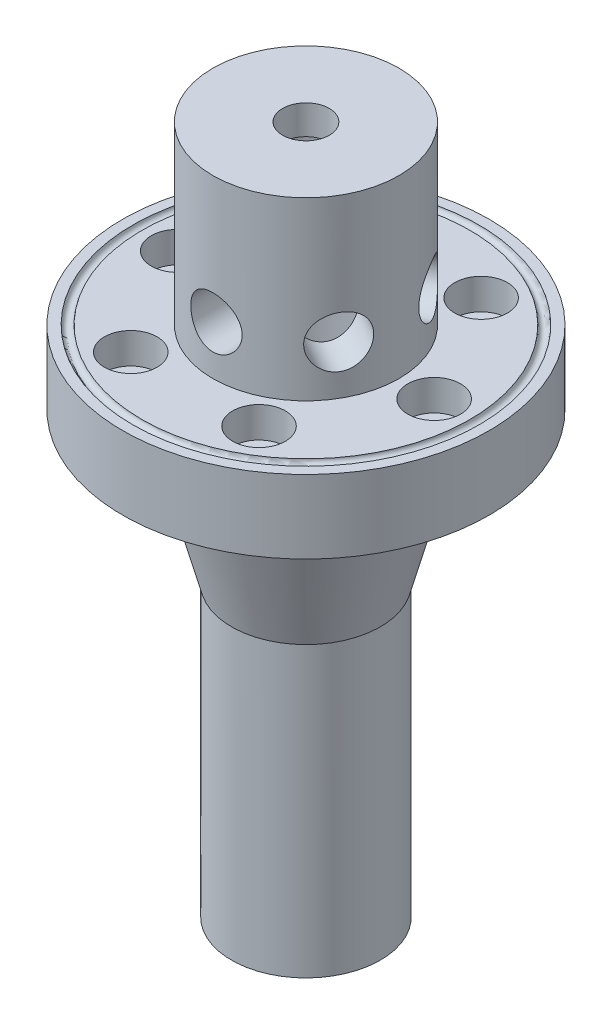
from build123d import *

# Parameters (mm, degrees)
SKETCH5_R                  = 7.5
CUT_EXTRUDE1_DEPTH         = 90
SKETCH6_R                  = 3.5
CUT_EXTRUDE2_DEPTH         = 20
CIRPATTERN1_COUNT          = 6
SKETCH11_R                 = 3.18
CUT_EXTRUDE4_DEPTH         = 101.429079548
F_4_2_4_2_DIAMETER_HOLE1_D = 4.2
CIRPATTERN2_COUNT          = 6
SKETCH15_R                 = 3.6
CUT_EXTRUDE5_DEPTH         = 4.2
CIRPATTERN3_COUNT          = 6
CUT_SWEEP1_PROFILE_R       = 0.625


with BuildPart() as part:
    # Sketch1 → Revolve1 (revolve)
    with BuildSketch(Plane(origin=(0, 0, 0), x_dir=(0, 0, -1), z_dir=(1, 0, 0))):
        Polygon((0, 34), (12.7, 34), (12.7, 10), (25, 10), (25, 0), (15.68, 0), (10.16, -20.600920458), (10.16, -60), (0, -60), align=None)
    revolve(axis=Axis((0, 0, 0), (0, 1, 0)))

    # Sketch5 → Cut-Extrude1 (cut)
    with BuildSketch(Plane.XZ.offset(60)):
        with Locations(Location((0, 0, 0), (0, 0, 270))):
            Circle(SKETCH5_R)
    extrude(amount=-CUT_EXTRUDE1_DEPTH, mode=Mode.SUBTRACT)

    # Sketch6 → Cut-Extrude2 (cut, symmetric)
    with BuildSketch(Plane.XY):
        with Locations((0, 16.659966967)):
            Circle(SKETCH6_R)
    cut_extrude2 = extrude(amount=CUT_EXTRUDE2_DEPTH, both=True, mode=Mode.SUBTRACT)

    # CirPattern1: Cut-Extrude2 ×6 about axis
    cirpattern1_axis = Axis((0, 34, 0), (0, -1, 0))
    for i in range(1, CIRPATTERN1_COUNT):
        add(cut_extrude2.rotate(cirpattern1_axis, i * 360 / CIRPATTERN1_COUNT), mode=Mode.SUBTRACT)

    # Sketch11 → Cut-Extrude4 (cut, through all)
    with BuildSketch(Plane(origin=(0, 34, 0), x_dir=(1, 0, 0), z_dir=(0, 1, 0))):
        with Locations(Location((0, 0, 0), (0, 0, 270))):
            Circle(SKETCH11_R)
    extrude(amount=-CUT_EXTRUDE4_DEPTH, mode=Mode.SUBTRACT)

    # Ø4.2 (4.2) Diameter Hole1 (through all)
    with Locations(Plane(origin=(0, 10, 0), x_dir=(1, 0, 0), z_dir=(0, 1, 0))):
        with Locations((-17.5, 0)):
            f_4_2_4_2_diameter_hole1 = Hole(F_4_2_4_2_DIAMETER_HOLE1_D / 2)

    # CirPattern2: Ø4.2 (4.2) Diameter Hole1 ×6 about axis
    cirpattern2_axis = Axis((0, 0, 0), (0, 1, 0))
    for i in range(1, CIRPATTERN2_COUNT):
        add(f_4_2_4_2_diameter_hole1.rotate(cirpattern2_axis, i * 360 / CIRPATTERN2_COUNT), mode=Mode.SUBTRACT)

    # Sketch15 → Cut-Extrude5 (cut)
    with BuildSketch(Plane(origin=(0, 10, 0), x_dir=(1, 0, 0), z_dir=(0, 1, 0))):
        with Locations(Location((-17.5, 0, 0), (0, 0, 270))):
            Circle(SKETCH15_R)
    cut_extrude5 = extrude(amount=-CUT_EXTRUDE5_DEPTH, mode=Mode.SUBTRACT)

    # CirPattern3: Cut-Extrude5 ×6 about axis
    cirpattern3_axis = Axis((0, 0, 0), (0, 1, 0))
    for i in range(1, CIRPATTERN3_COUNT):
        add(cut_extrude5.rotate(cirpattern3_axis, i * 360 / CIRPATTERN3_COUNT), mode=Mode.SUBTRACT)

    # Cut-Sweep1: sweep along a path in Sketch16
    with BuildLine(Plane(origin=(0, 10, 0), x_dir=(1, 0, 0), z_dir=(0, 1, 0))) as cut_sweep1_path:
        CenterArc((0, 0), 23, 0, 360)
    # Cut-Sweep1 profile (on start of the path) → Cut-Sweep1 (sweep, cut)
    with BuildSketch(Plane(origin=(23, 10, 0), x_dir=(-1, 0, 0), z_dir=(0, 0, -1))):
        Circle(CUT_SWEEP1_PROFILE_R)
    sweep(path=cut_sweep1_path.line, mode=Mode.SUBTRACT)


solid = part.part
